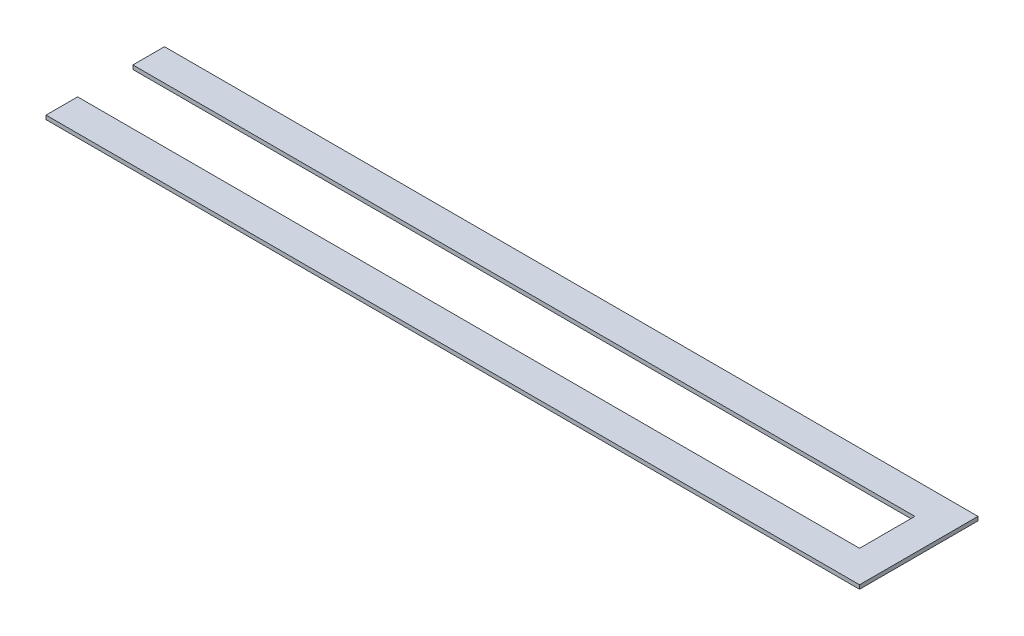
from build123d import *

# Parameters (mm, degrees)
BOSS_EXTRUDE1_DEPTH = 1


with BuildPart() as part:
    # Sketch7 → Boss-Extrude1 (new body)
    with BuildSketch(Plane(origin=(0, 0, 0), x_dir=(1, 0, 0), z_dir=(0, 1, 0))):
        Polygon((-206, 8), (-8, 8), (-8, 22), (-206, 22), (-206, 30), (0, 30), (0, 0), (-206, 0), align=None)
    extrude(amount=BOSS_EXTRUDE1_DEPTH)


solid = part.part
